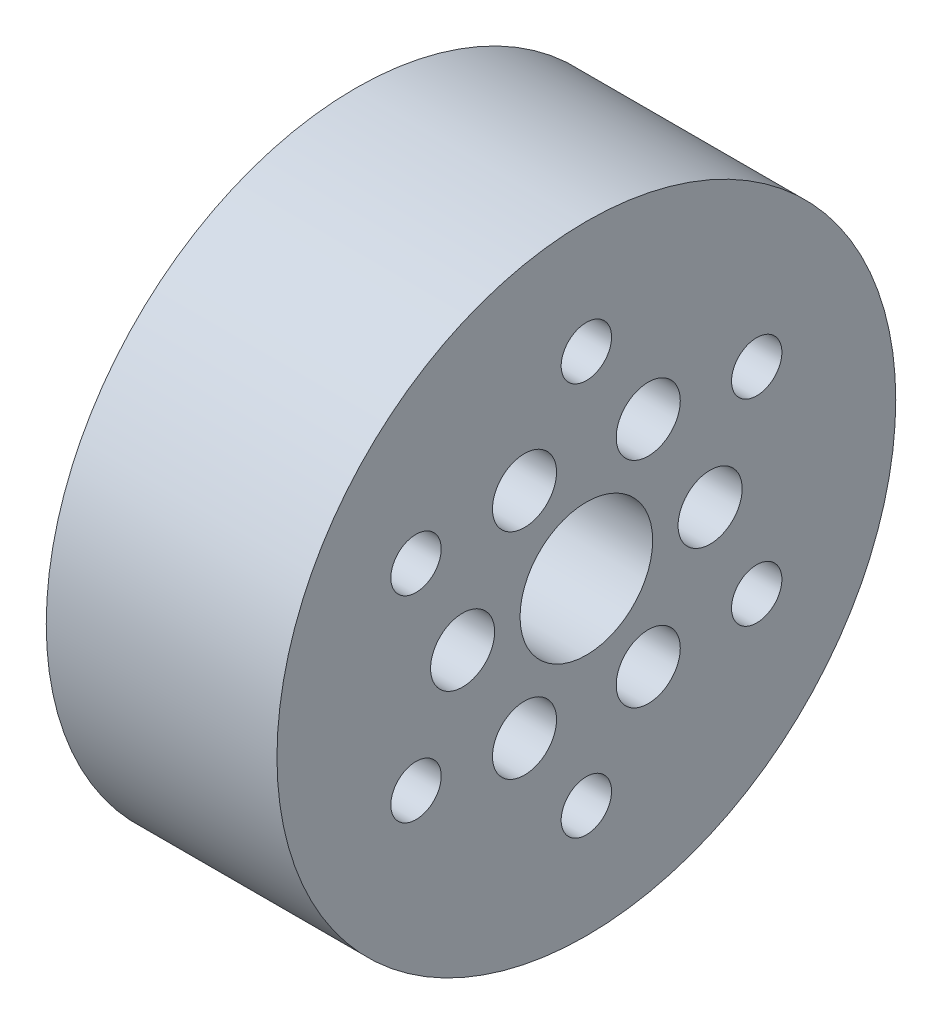
from build123d import *

# Parameters (mm, degrees)
SKETCH13_R          = 35
SKETCH13_R_2        = 7.5
BOSS_EXTRUDE1_DEPTH = 23
SKETCH14_R          = 2.05
CUT_EXTRUDE1_DEPTH  = 55.580216196
SKETCH16_R          = 2.85
SKETCH16_R_2        = 2.05
CUT_EXTRUDE2_DEPTH  = 16.5
SKETCH16_4_R        = 2.85
SKETCH16_4_R_2      = 2.05
CUT_EXTRUDE3_DEPTH  = 8.5
SKETCH18_R          = 35
SKETCH18_R_2        = 7.5
SKETCH18_R_3        = 2.05
BOSS_EXTRUDE2_DEPTH = 3.1
SKETCH19_R          = 3.625
CUT_EXTRUDE4_DEPTH  = 9.5


with BuildPart() as part:
    # Sketch13 → Boss-Extrude1 (new body)
    with BuildSketch(Plane(origin=(0, 0, 0), x_dir=(0, 0, -1), z_dir=(1, 0, 0))):
        Circle(SKETCH13_R)
        Circle(SKETCH13_R_2, mode=Mode.SUBTRACT)
    extrude(amount=BOSS_EXTRUDE1_DEPTH)

    # Sketch14 → Cut-Extrude1 (cut, through all)
    with BuildSketch(Plane(origin=(23, 0, 0), x_dir=(0, 0, -1), z_dir=(1, 0, 0))):
        with Locations((14, 0)):
            Circle(SKETCH14_R)
        with Locations((19.269065234, -11.125)):
            Circle(SKETCH14_R)
        with Locations((7, 12.124355653)):
            Circle(SKETCH14_R)
        with Locations((19.269065234, 11.125)):
            Circle(SKETCH14_R)
        with Locations((-7, 12.124355653)):
            Circle(SKETCH14_R)
        with Locations((0, 22.25)):
            Circle(SKETCH14_R)
        with Locations((-14, 0)):
            Circle(SKETCH14_R)
        with Locations((-19.269065234, 11.125)):
            Circle(SKETCH14_R)
        with Locations((-7, -12.124355653)):
            Circle(SKETCH14_R)
        with Locations((-19.269065234, -11.125)):
            Circle(SKETCH14_R)
        with Locations((7, -12.124355653)):
            Circle(SKETCH14_R)
        with Locations((0, -22.25)):
            Circle(SKETCH14_R)
    extrude(amount=-CUT_EXTRUDE1_DEPTH, mode=Mode.SUBTRACT)

    # Sketch16 → Cut-Extrude2 (cut)
    # profile 1 of 6: a face of its own
    with BuildSketch(Plane(origin=(23, 0, 0), x_dir=(0, 0, -1), z_dir=(1, 0, 0))):
        with Locations((-14, 0)):
            Circle(SKETCH16_R)
    # profile 2 of 6: a face of its own
    with BuildSketch(Plane(origin=(23, 0, 0), x_dir=(0, 0, -1), z_dir=(1, 0, 0))):
        with Locations((-7, -12.124355653)):
            Circle(SKETCH16_R)
    # profile 3 of 6: a face of its own
    with BuildSketch(Plane(origin=(23, 0, 0), x_dir=(0, 0, -1), z_dir=(1, 0, 0))):
        with Locations((7, -12.124355653)):
            Circle(SKETCH16_R)
    # profile 4 of 6: a face of its own
    with BuildSketch(Plane(origin=(23, 0, 0), x_dir=(0, 0, -1), z_dir=(1, 0, 0))):
        with Locations((14, 0)):
            Circle(SKETCH16_R)
        with Locations((14, 0)):
            Circle(SKETCH16_R_2, mode=Mode.SUBTRACT)
    # profile 5 of 6: a face of its own
    with BuildSketch(Plane(origin=(23, 0, 0), x_dir=(0, 0, -1), z_dir=(1, 0, 0))):
        with Locations((7, 12.124355653)):
            Circle(SKETCH16_R)
    # profile 6 of 6: a face of its own
    with BuildSketch(Plane(origin=(23, 0, 0), x_dir=(0, 0, -1), z_dir=(1, 0, 0))):
        with Locations((-7, 12.124355653)):
            Circle(SKETCH16_R)
    extrude(amount=-CUT_EXTRUDE2_DEPTH, mode=Mode.SUBTRACT)

    # Sketch16<4> → Cut-Extrude3 (cut)
    # profile 1 of 6: a face of its own
    with BuildSketch(Plane(origin=(23, 0, 0), x_dir=(0, 0, -1), z_dir=(1, 0, 0))):
        with Locations((-19.269065234, -11.125)):
            Circle(SKETCH16_4_R)
    # profile 2 of 6: a face of its own
    with BuildSketch(Plane(origin=(23, 0, 0), x_dir=(0, 0, -1), z_dir=(1, 0, 0))):
        with Locations((0, -22.25)):
            Circle(SKETCH16_4_R)
        with Locations((0, -22.25)):
            Circle(SKETCH16_4_R_2, mode=Mode.SUBTRACT)
    # profile 3 of 6: a face of its own
    with BuildSketch(Plane(origin=(23, 0, 0), x_dir=(0, 0, -1), z_dir=(1, 0, 0))):
        with Locations((19.269065234, -11.125)):
            Circle(SKETCH16_4_R)
    # profile 4 of 6: a face of its own
    with BuildSketch(Plane(origin=(23, 0, 0), x_dir=(0, 0, -1), z_dir=(1, 0, 0))):
        with Locations((19.269065234, 11.125)):
            Circle(SKETCH16_4_R)
        with Locations((19.269065234, 11.125)):
            Circle(SKETCH16_4_R_2, mode=Mode.SUBTRACT)
    # profile 5 of 6: a face of its own
    with BuildSketch(Plane(origin=(23, 0, 0), x_dir=(0, 0, -1), z_dir=(1, 0, 0))):
        with Locations((0, 22.25)):
            Circle(SKETCH16_4_R)
    # profile 6 of 6: a face of its own
    with BuildSketch(Plane(origin=(23, 0, 0), x_dir=(0, 0, -1), z_dir=(1, 0, 0))):
        with Locations((-19.269065234, 11.125)):
            Circle(SKETCH16_4_R)
    extrude(amount=-CUT_EXTRUDE3_DEPTH, mode=Mode.SUBTRACT)

    # Sketch18 → Boss-Extrude2 (add)
    with BuildSketch(Plane.ZY):
        Circle(SKETCH18_R)
        Circle(SKETCH18_R_2, mode=Mode.SUBTRACT)
        with Locations((-14, 0)):
            Circle(SKETCH18_R_3, mode=Mode.SUBTRACT)
        with Locations((-19.269065234, 11.125)):
            Circle(SKETCH18_R_3, mode=Mode.SUBTRACT)
        with Locations((-7, 12.124355653)):
            Circle(SKETCH18_R_3, mode=Mode.SUBTRACT)
        with Locations((0, 22.25)):
            Circle(SKETCH18_R_3, mode=Mode.SUBTRACT)
        with Locations((7, 12.124355653)):
            Circle(SKETCH18_R_3, mode=Mode.SUBTRACT)
        with Locations((19.269065234, 11.125)):
            Circle(SKETCH18_R_3, mode=Mode.SUBTRACT)
        with Locations((14, 0)):
            Circle(SKETCH18_R_3, mode=Mode.SUBTRACT)
        with Locations((19.269065234, -11.125)):
            Circle(SKETCH18_R_3, mode=Mode.SUBTRACT)
        with Locations((7, -12.124355653)):
            Circle(SKETCH18_R_3, mode=Mode.SUBTRACT)
        with Locations((0, -22.25)):
            Circle(SKETCH18_R_3, mode=Mode.SUBTRACT)
        with Locations((-7, -12.124355653)):
            Circle(SKETCH18_R_3, mode=Mode.SUBTRACT)
        with Locations((-19.269065234, -11.125)):
            Circle(SKETCH18_R_3, mode=Mode.SUBTRACT)
    extrude(amount=BOSS_EXTRUDE2_DEPTH)

    # Sketch19 → Cut-Extrude4 (cut)
    with BuildSketch(Plane(origin=(23, 0, 0), x_dir=(0, 0, -1), z_dir=(1, 0, 0))):
        with Locations((-7, 12.124355653)):
            Circle(SKETCH19_R)
        with Locations((7, 12.124355653)):
            Circle(SKETCH19_R)
        with Locations((14, 0)):
            Circle(SKETCH19_R)
        with Locations((7, -12.124355653)):
            Circle(SKETCH19_R)
        with Locations((-7, -12.124355653)):
            Circle(SKETCH19_R)
        with Locations((-14, 0)):
            Circle(SKETCH19_R)
    extrude(amount=-CUT_EXTRUDE4_DEPTH, mode=Mode.SUBTRACT)


solid = part.part
